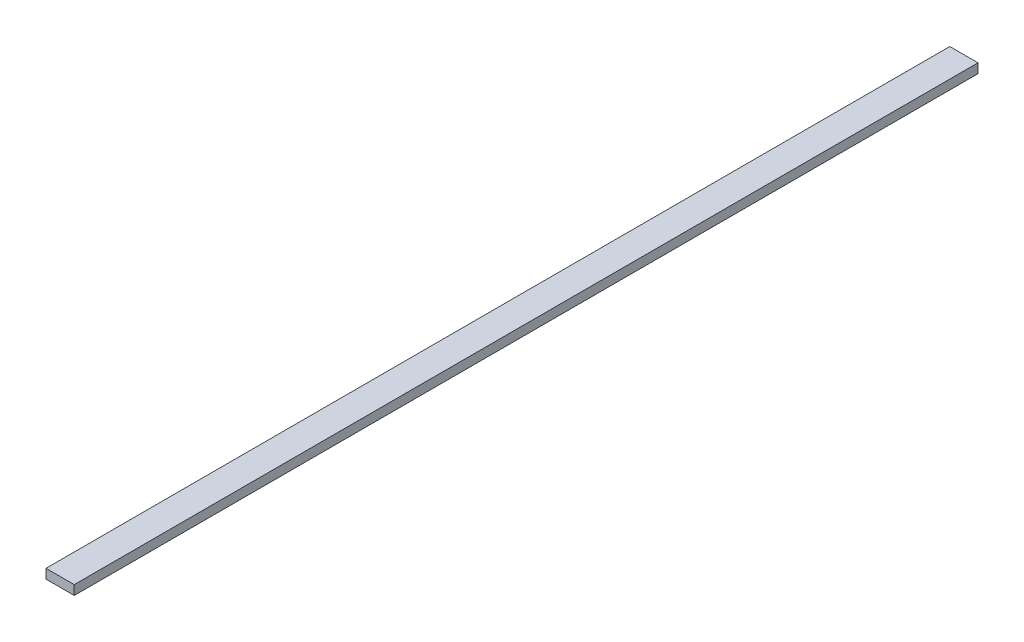
from build123d import *

# Parameters (mm, degrees)
SKETCH1_W           = 38.1
SKETCH1_H           = 12.7
BOSS_EXTRUDE1_DEPTH = 1219.2


with BuildPart() as part:
    # Sketch1 → Boss-Extrude1 (new body)
    with BuildSketch(Plane.XY):
        with Locations((19.05, 6.35)):
            Rectangle(SKETCH1_W, SKETCH1_H)
    extrude(amount=BOSS_EXTRUDE1_DEPTH)


solid = part.part
